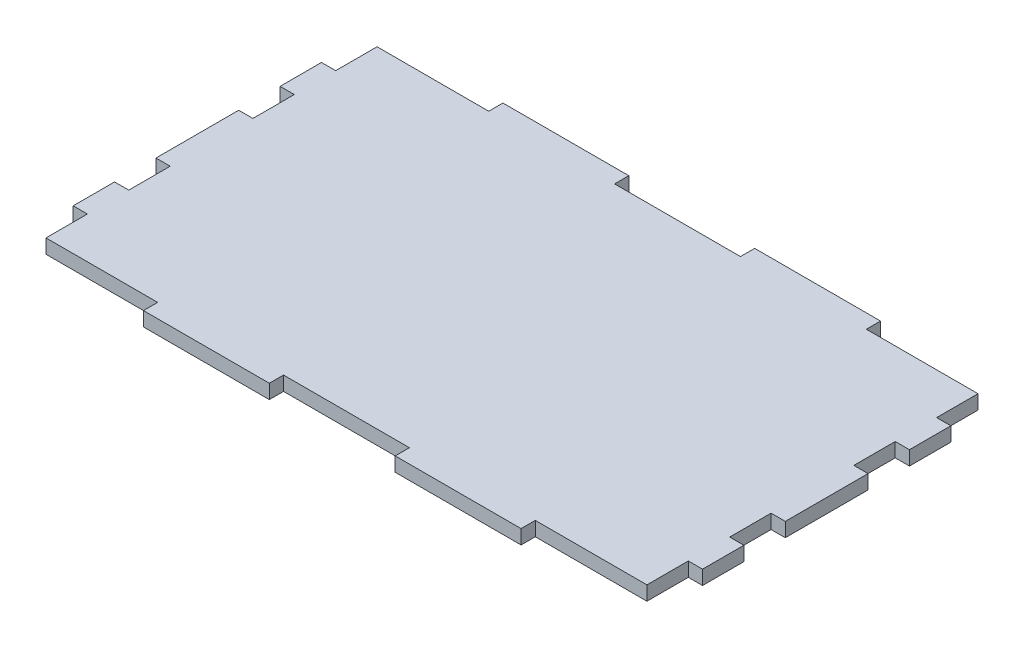
from build123d import *

# Parameters (mm, degrees)
SKETCH1_W           = 369.1255
SKETCH1_H           = 210.8454
BOSS_EXTRUDE1_DEPTH = 8.3312
SKETCH2_W           = 8.3312
SKETCH2_H           = 24.272875
SKETCH2_W_2         = 36.91255
SKETCH2_H_2         = 8.3312
SKETCH2_W_3         = 73.8251
CUT_EXTRUDE1_DEPTH  = 277.171250991


with BuildPart() as part:
    # Sketch1 → Boss-Extrude1 (new body)
    with BuildSketch(Plane(origin=(0, 0, 0), x_dir=(1, 0, 0), z_dir=(0, 1, 0))):
        with Locations((-29.797014585, -68.505567707)):
            Rectangle(SKETCH1_W, SKETCH1_H)
    extrude(amount=BOSS_EXTRUDE1_DEPTH)

    # Sketch2 → Cut-Extrude1 (cut, through all)
    with BuildSketch(Plane(origin=(0, 8.3312, 0), x_dir=(1, 0, 0), z_dir=(0, 1, 0))):
        with Locations((-210.194164585, -104.914880207)):
            Rectangle(SKETCH2_W, SKETCH2_H)
        with Locations((-210.194164585, -153.460630207)):
            Rectangle(SKETCH2_W, SKETCH2_H)
        Polygon((-214.359764585, -173.928267707), (-140.534664585, -173.928267707), (-140.534664585, -165.597067707), (-206.028564585, -165.597067707), (-214.359764585, -165.597067707), align=None)
        with Locations((-11.340739585, -169.762667707)):
            Rectangle(SKETCH2_W_2, SKETCH2_H_2)
        with Locations((-48.253289585, -169.762667707)):
            Rectangle(SKETCH2_W_2, SKETCH2_H_2)
        with Locations((117.853185415, -169.762667707)):
            Rectangle(SKETCH2_W_3, SKETCH2_H_2)
        with Locations((150.600135415, -153.460630207)):
            Rectangle(SKETCH2_W, SKETCH2_H)
        with Locations((150.600135415, -104.914880207)):
            Rectangle(SKETCH2_W, SKETCH2_H)
        with Locations((150.600135415, -32.096255207)):
            Rectangle(SKETCH2_W, SKETCH2_H)
        with Locations((150.600135415, 16.449494793)):
            Rectangle(SKETCH2_W, SKETCH2_H)
        with Locations((117.853185415, 32.751532293)):
            Rectangle(SKETCH2_W_3, SKETCH2_H_2)
        with Locations((-29.797014585, 32.751532293)):
            Rectangle(SKETCH2_W_3, SKETCH2_H_2)
        with Locations((-210.194164585, -32.096255207)):
            Rectangle(SKETCH2_W, SKETCH2_H)
        with Locations((-210.194164585, 16.449494793)):
            Rectangle(SKETCH2_W, SKETCH2_H)
        with Locations((-177.447214585, 32.751532293)):
            Rectangle(SKETCH2_W_3, SKETCH2_H_2)
    extrude(amount=-CUT_EXTRUDE1_DEPTH, mode=Mode.SUBTRACT)


solid = part.part
